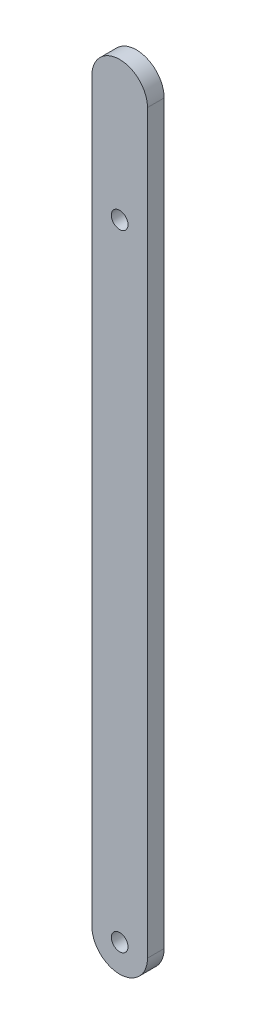
from build123d import *

# Parameters (mm, degrees)
BOSS_EXTRUDE1_DEPTH = 6
SKETCH2_R           = 3
CUT_EXTRUDE1_DEPTH  = 236.289183772
BOSS_EXTRUDE2_START = -6
BOSS_EXTRUDE2_DEPTH = 6


with BuildPart() as part:
    # Sketch1 → Boss-Extrude1 (new body)
    with BuildSketch(Plane.XY):
        with BuildLine():
            Line((-10, 0), (-10, 225))
            ThreePointArc((-10, 225), (0, 235), (10, 225))
            Line((10, 225), (10, 0))
            ThreePointArc((10, 0), (0, -10), (-10, 0))
        make_face()
    extrude(amount=BOSS_EXTRUDE1_DEPTH)

    # Sketch2 → Cut-Extrude1 (cut, through all)
    with BuildSketch(Plane.XY.offset(6)):
        with Locations((0, 225)):
            Circle(SKETCH2_R)
        Circle(SKETCH2_R)
    extrude(amount=-CUT_EXTRUDE1_DEPTH, mode=Mode.SUBTRACT)

    # Sketch3 → Boss-Extrude2 (add)
    with BuildSketch(Plane.XY.offset(6).offset(BOSS_EXTRUDE2_START)):
        with BuildLine():
            Line((-10, 225), (-10, 265))
            ThreePointArc((-10, 265), (0, 275), (10, 265))
            Line((10, 265), (10, 225))
            ThreePointArc((10, 225), (0, 235), (-10, 225))
        make_face()
    extrude(amount=BOSS_EXTRUDE2_DEPTH)


solid = part.part
